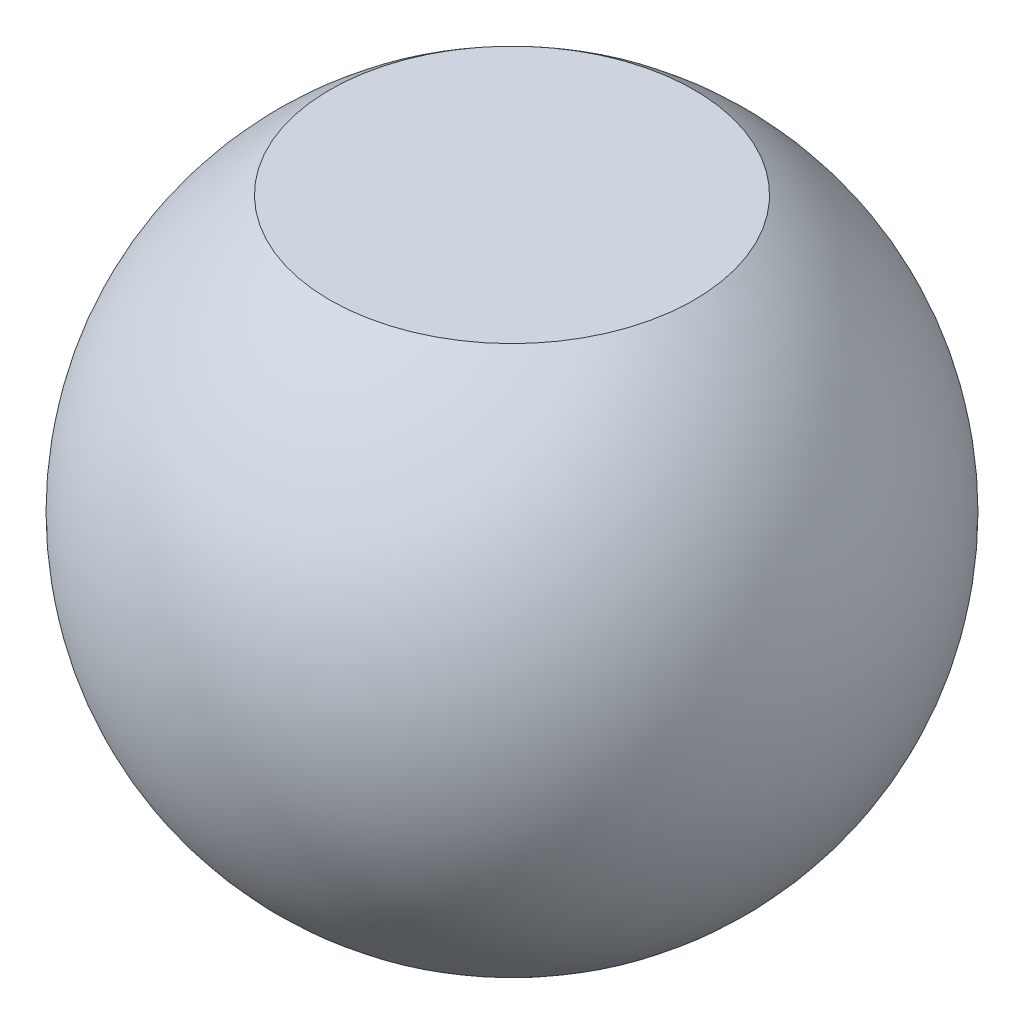
from build123d import *

# Parameters (mm, degrees)
ESQUISSE2_R             = 3
ENL_V_MAT_EXTRU_1_DEPTH = 30.546573405
ESQUISSE3_R             = 1.5
ENL_V_MAT_EXTRU_2_DEPTH = 30.54657341


with BuildPart() as part:
    # Esquisse1 → Révolution1 (revolve)
    with BuildSketch(Plane.XY):
        with BuildLine():
            Line((0, 15), (0, -15))
            Line((0, -15), (-9.949874371, -15))
            ThreePointArc((-9.949874371, -15), (-18, 0), (-9.949874371, 15))
            Line((-9.949874371, 15), (0, 15))
        make_face()
    revolve(axis=Axis((0, 15, 0), (0, -1, 0)))

    # Esquisse2 → Enlèv. mat.-Extru.1 (cut, through all)
    with BuildSketch(Plane(origin=(0, 0, 0), x_dir=(0, 0, -1), z_dir=(1, 0, 0))):
        Circle(ESQUISSE2_R)
    extrude(amount=-ENL_V_MAT_EXTRU_1_DEPTH, mode=Mode.SUBTRACT)

    # Esquisse3 → Enlèv. mat.-Extru.2 (cut, through all)
    with BuildSketch(Plane(origin=(0, 0, 0), x_dir=(0, 0, -1), z_dir=(1, 0, 0))):
        with Locations((0, -10.5)):
            Circle(ESQUISSE3_R)
    extrude(amount=-ENL_V_MAT_EXTRU_2_DEPTH, mode=Mode.SUBTRACT)


solid = part.part
